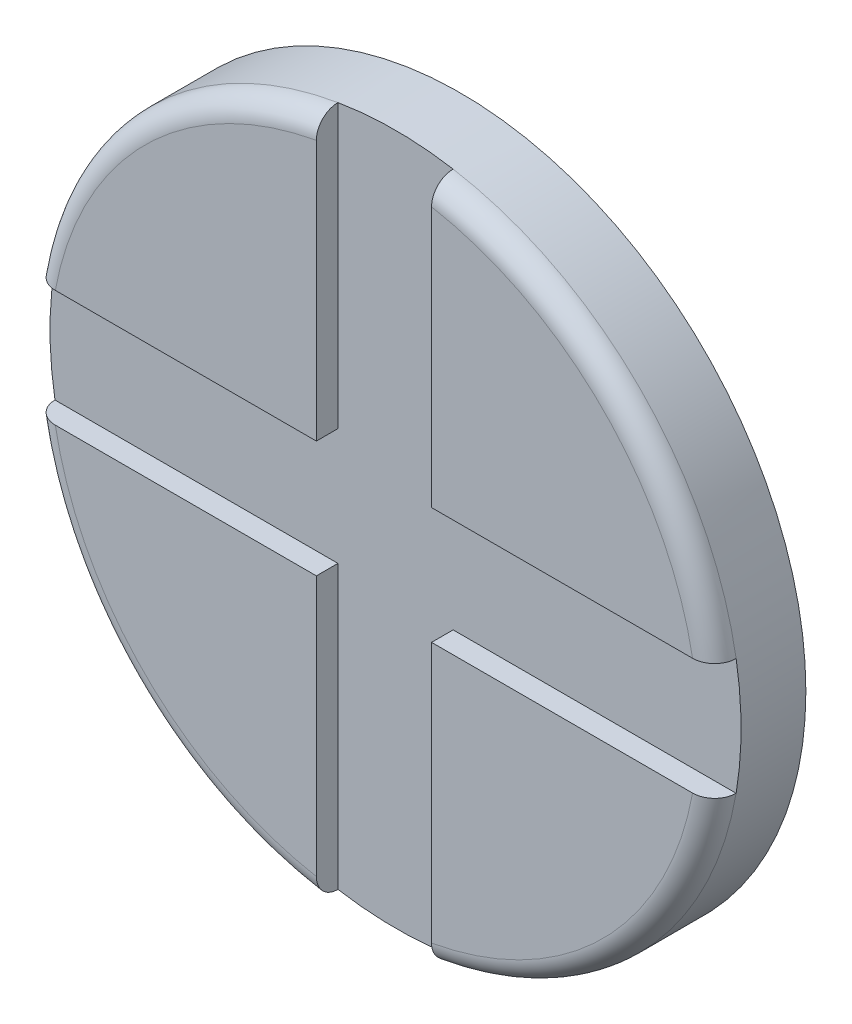
from build123d import *

# Parameters (mm, degrees)
SKETCH1_R           = 4
BOSS_EXTRUDE1_DEPTH = 1
CUT_EXTRUDE1_DEPTH  = 0.25
FILLET1_R           = 0.25


with BuildPart() as part:
    # Sketch1 → Boss-Extrude1 (new body)
    with BuildSketch(Plane.XY):
        Circle(SKETCH1_R)
    extrude(amount=BOSS_EXTRUDE1_DEPTH)

    # Sketch2 → Cut-Extrude1 (cut)
    with BuildSketch(Plane.XY.offset(1)):
        Polygon((-8.106259115, 0.675521593), (-0.666748585, 0.675521593), (-0.666748585, 8.465952431), (0.666748585, 8.465952431), (0.666748585, 0.675521593), (8.106259115, 0.675521593), (8.106259115, -0.675521593), (0.666748585, -0.675521593), (0.666748585, -8.465952431), (-0.666748585, -8.465952431), (-0.666748585, -0.675521593), (-8.106259115, -0.675521593), align=None)
    extrude(amount=-CUT_EXTRUDE1_DEPTH, mode=Mode.SUBTRACT)

    # Fillet1
    fillet1_edges = [part.edges().sort_by_distance(p)[0] for p in [
        (2.825279045, 2.831571704, 1),
        (2.825279045, -2.831571704, 1),
        (-2.825279045, -2.831571704, 1),
        (-2.825279045, 2.831571704, 1),
    ]]
    fillet(fillet1_edges, radius=FILLET1_R)


solid = part.part
